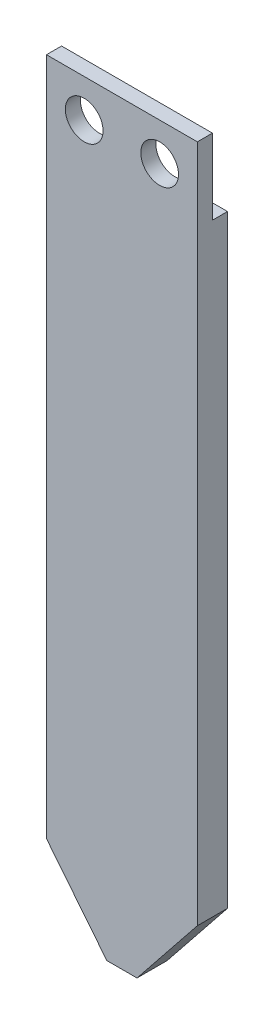
from build123d import *

# Parameters (mm, degrees)
SKETCH_1_W          = 20
SKETCH_1_H          = 100
EXTRUDE_1_DEPTH     = 4
SKETCH_2_R          = 2.5
CUT_EXTRUDE_1_DEPTH = 103.058806577
SKETCH_3_W          = 20
SKETCH_3_H          = 10
CUT_EXTRUDE_2_DEPTH = 2
CUT_EXTRUDE_3_DEPTH = 103.058806577


with BuildPart() as part:
    # 草图1 → 凸台-拉伸1 (new body)
    with BuildSketch(Plane.XY):
        with Locations((10, -50)):
            Rectangle(SKETCH_1_W, SKETCH_1_H)
    extrude(amount=EXTRUDE_1_DEPTH)

    # 草图2 → 切除-拉伸1 (cut, through all)
    with BuildSketch(Plane.XY.offset(4)):
        with Locations((5, -5)):
            Circle(SKETCH_2_R)
        with Locations((15, -5)):
            Circle(SKETCH_2_R)
    extrude(amount=-CUT_EXTRUDE_1_DEPTH, mode=Mode.SUBTRACT)

    # 草图3 → 切除-拉伸2 (cut)
    with BuildSketch(Plane(origin=(0, 0, 0), x_dir=(-1, 0, 0), z_dir=(0, 0, -1))):
        with Locations((-10, -5)):
            Rectangle(SKETCH_3_W, SKETCH_3_H)
    extrude(amount=-CUT_EXTRUDE_2_DEPTH, mode=Mode.SUBTRACT)

    # 草图4 → 切除-拉伸3 (cut, through all)
    with BuildSketch(Plane.XY.offset(4)):
        Polygon((0, -90), (0, -100), (8, -100), align=None)
        Polygon((20, -100), (12, -100), (20, -90), align=None)
    extrude(amount=-CUT_EXTRUDE_3_DEPTH, mode=Mode.SUBTRACT)


solid = part.part
